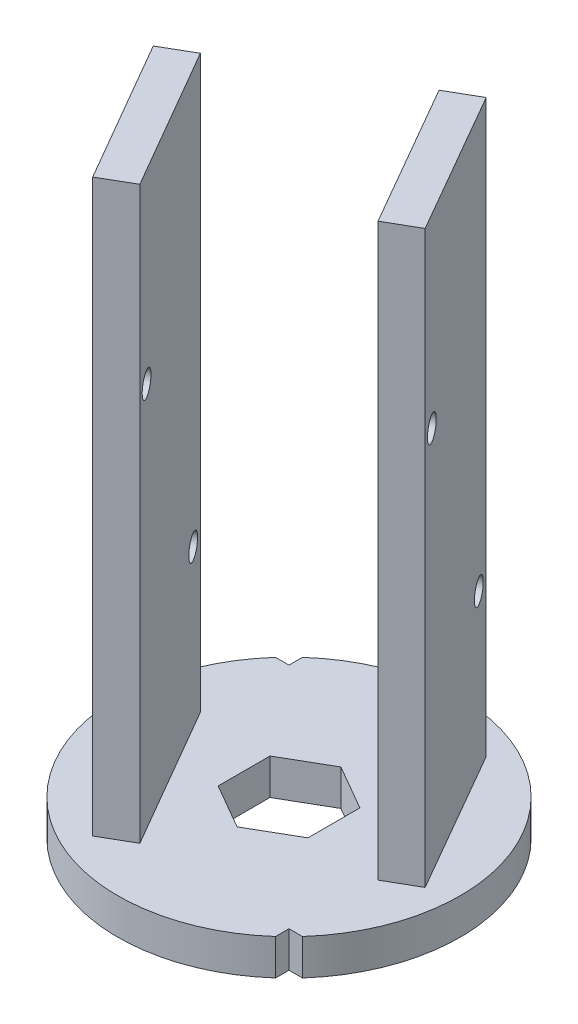
from build123d import *

# Parameters (mm, degrees)
BOSS_EXTRUDE1_DEPTH = 8
BOSS_EXTRUDE3_DEPTH = 127
SKETCH8_R           = 2.667
CUT_EXTRUDE1_DEPTH  = 127


with BuildPart() as part:
    # Sketch2 → Boss-Extrude1 (new body)
    with BuildSketch(Plane(origin=(0, 0, 0), x_dir=(1, 0, 0), z_dir=(0, 1, 0))):
        with BuildLine():
            ThreePointArc((-28.398063314, 25.4), (-26.940768363, -26.940768363), (25.4, -28.398063314))
            Line((25.4, -28.398063314), (25.4, -25.4))
            Line((25.4, -25.4), (28.398063314, -25.4))
            ThreePointArc((28.398063314, -25.4), (26.940768363, 26.940768363), (-25.4, 28.398063314))
            Line((-25.4, 28.398063314), (-25.4, 25.4))
            Line((-25.4, 25.4), (-28.398063314, 25.4))
        make_face()
        Polygon((10, 5.773502692), (10, -5.773502692), (0, -11.547005384), (-10, -5.773502692), (-10, 5.773502692), (0, 11.547005384), align=None, mode=Mode.SUBTRACT)
    extrude(amount=BOSS_EXTRUDE1_DEPTH)

    # Sketch7 → Boss-Extrude3 (add)
    with BuildSketch(Plane(origin=(0, 8, 0), x_dir=(1, 0, 0), z_dir=(0, 1, 0))):
        Polygon((-32.824735076, 2.610171349), (-14.307691077, -29.37771274), (-7.659250908, -25.529084967), (-26.176294907, 6.458799122), align=None)
    boss_extrude3 = extrude(amount=BOSS_EXTRUDE3_DEPTH)

    # Mirror1: Boss-Extrude3 across plane
    add(boss_extrude3.mirror(Plane(origin=(-21.745710428, -1.979026449, -37.664675308), x_dir=(0.4999999999999996, 0, 0.8660254037844389), z_dir=(0.8660254037844389, 0, -0.4999999999999996))))

    # Sketch8 → Cut-Extrude1 (cut)
    with BuildSketch(Plane(origin=(23.485284585, 0, -13.523431686), x_dir=(-0.49900881712180367, 0, -0.8665969076997092), z_dir=(0.8665969076997092, 0, -0.49900881712180367))):
        with Locations((-14.202194794, 93.725)):
            Circle(SKETCH8_R)
        with Locations((14.245786586, 42.925)):
            Circle(SKETCH8_R)
    extrude(amount=-CUT_EXTRUDE1_DEPTH, mode=Mode.SUBTRACT)


solid = part.part
